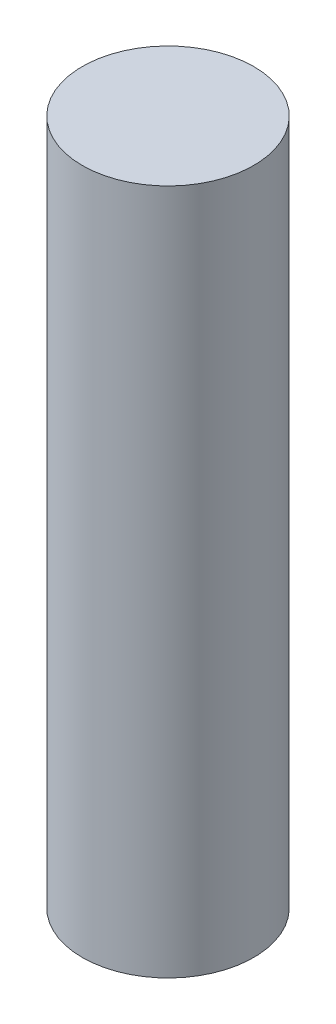
from build123d import *

# Parameters (mm, degrees)
SKETCH2_R           = 6.35
BOSS_EXTRUDE1_DEPTH = 50.8


with BuildPart() as part:
    # Sketch2 → Boss-Extrude1 (new body)
    with BuildSketch(Plane(origin=(0, 0, 0), x_dir=(1, 0, 0), z_dir=(0, 1, 0))):
        with Locations(Location((0, 0, 0), (0, 0, 270))):
            Circle(SKETCH2_R)
    extrude(amount=BOSS_EXTRUDE1_DEPTH)


solid = part.part
